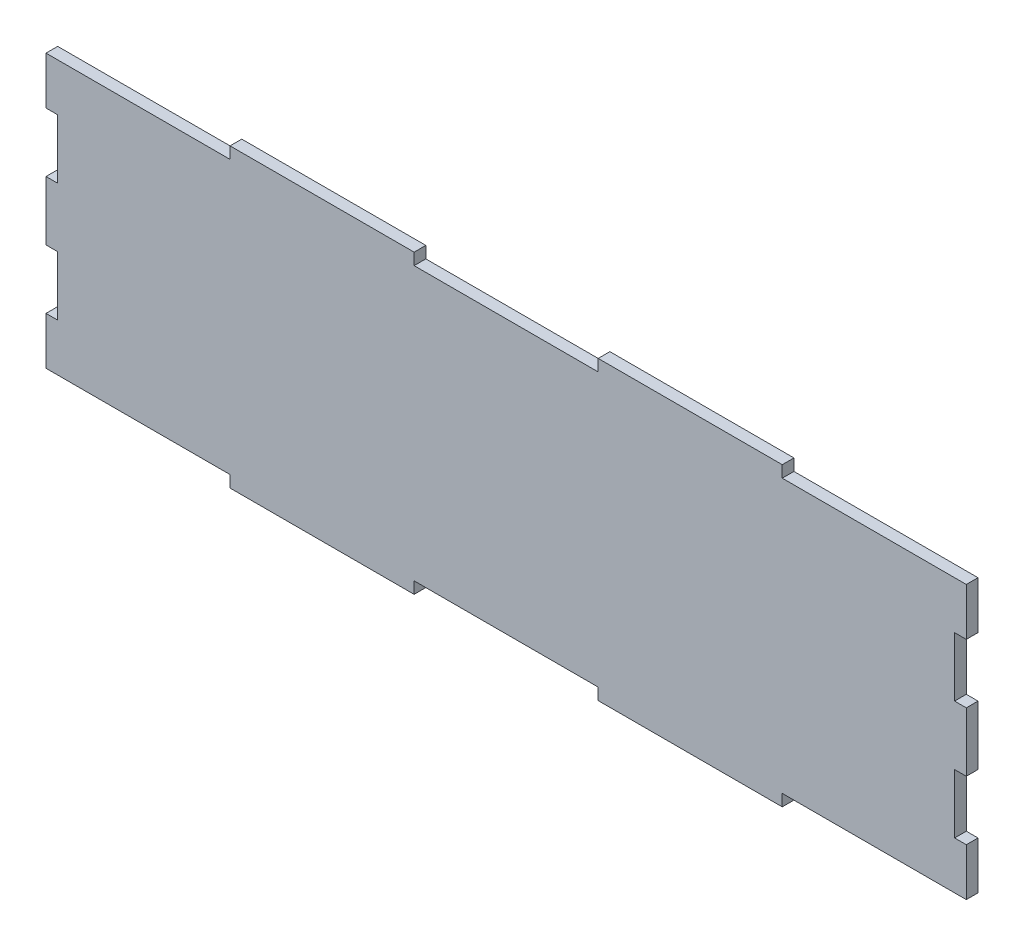
from build123d import *

# Parameters (mm, degrees)
BOSS_EXTRU_1_DEPTH = 3


with BuildPart() as part:
    # Esquisse1 → Boss.-Extru.1 (new body)
    with BuildSketch(Plane.XY):
        Polygon((-101.958541142, 39.199791836), (-57.758541142, 39.199791836), (-57.758541142, 42.199791836), (-10.558541142, 42.199791836), (-10.558541142, 39.199791836), (36.641458858, 39.199791836), (36.641458858, 42.199791836), (83.841458858, 42.199791836), (83.841458858, 39.199791836), (128.041458858, 39.199791836), (131.041458858, 39.199791836), (131.041458858, 26.999791836), (128.041458858, 26.999791836), (128.041458858, 11.799791836), (131.041458858, 11.799791836), (131.041458858, -3.400208164), (128.041458858, -3.400208164), (128.041458858, -18.600208164), (131.041458858, -18.600208164), (131.041458858, -30.800208164), (128.041458858, -30.800208164), (83.841458858, -30.800208164), (83.841458858, -33.800208164), (36.641458858, -33.800208164), (36.641458858, -30.800208164), (-10.558541142, -30.800208164), (-10.558541142, -33.800208164), (-57.758541142, -33.800208164), (-57.758541142, -30.800208164), (-101.958541142, -30.800208164), (-104.958541142, -30.800208164), (-104.958541142, -18.600208164), (-101.958541142, -18.600208164), (-101.958541142, -3.400208164), (-104.958541142, -3.400208164), (-104.958541142, 11.799791836), (-101.958541142, 11.799791836), (-101.958541142, 26.999791836), (-104.958541142, 26.999791836), (-104.958541142, 39.199791836), align=None)
    extrude(amount=BOSS_EXTRU_1_DEPTH)


solid = part.part
